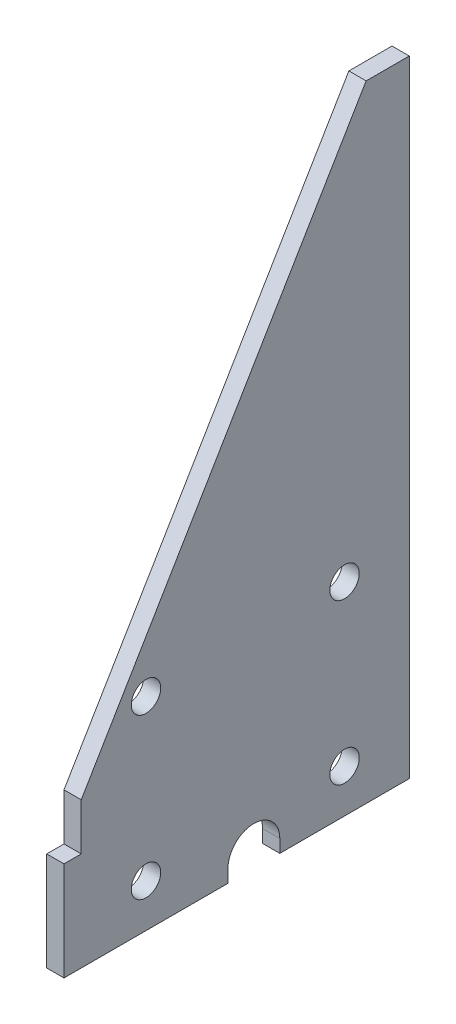
from build123d import *

# Parameters (mm, degrees)
BOSS_EXTRUDE1_DEPTH = 4
CUT_EXTRUDE1_REACH  = 99.14
SKETCH3_R           = 3.41
CUT_EXTRUDE2_REACH  = 99.14
SKETCH4_R           = 3.41
CUT_EXTRUDE4_REACH  = 99.14


with BuildPart() as part:
    # Sketch1 → Boss-Extrude1 (new body)
    with BuildSketch(Plane(origin=(0, 0, 0), x_dir=(0, 0, -1), z_dir=(1, 0, 0))):
        Polygon((-38, -57.5), (42, -57.5), (42, 87.5), (32, 87.5), (-34, -23.740343039), (-34, -34.602813771), (-38, -34.602813771), align=None)
    extrude(amount=BOSS_EXTRUDE1_DEPTH)

    # Sketch3 → Cut-Extrude1 (cut, up to next)
    with BuildSketch(Plane.ZY, mode=Mode.PRIVATE) as cut_extrude1_sk1:
        with Locations((-27, -10.5)):
            Circle(SKETCH3_R)
    cut_extrude1_tool1 = extrude(cut_extrude1_sk1.sketch, amount=-CUT_EXTRUDE1_REACH, mode=Mode.PRIVATE) & part.part
    # Sketch3 → Cut-Extrude1 (cut, up to next)
    with BuildSketch(Plane.ZY, mode=Mode.PRIVATE) as cut_extrude1_sk2:
        with Locations((19, -10.5)):
            Circle(SKETCH3_R)
    cut_extrude1_tool2 = extrude(cut_extrude1_sk2.sketch, amount=-CUT_EXTRUDE1_REACH, mode=Mode.PRIVATE) & part.part
    add(cut_extrude1_tool1.solids().sort_by_distance((0, -10.5, -27))[0], mode=Mode.SUBTRACT)
    add(cut_extrude1_tool2.solids().sort_by_distance((0, -10.5, 19))[0], mode=Mode.SUBTRACT)

    # Sketch4 → Cut-Extrude2 (cut, up to next)
    with BuildSketch(Plane.ZY, mode=Mode.PRIVATE) as cut_extrude2_sk1:
        with Locations((-27, -47.5)):
            Circle(SKETCH4_R)
    cut_extrude2_tool1 = extrude(cut_extrude2_sk1.sketch, amount=-CUT_EXTRUDE2_REACH, mode=Mode.PRIVATE) & part.part
    # Sketch4 → Cut-Extrude2 (cut, up to next)
    with BuildSketch(Plane.ZY, mode=Mode.PRIVATE) as cut_extrude2_sk2:
        with Locations((19, -47.5)):
            Circle(SKETCH4_R)
    cut_extrude2_tool2 = extrude(cut_extrude2_sk2.sketch, amount=-CUT_EXTRUDE2_REACH, mode=Mode.PRIVATE) & part.part
    add(cut_extrude2_tool1.solids().sort_by_distance((0, -47.5, -27))[0], mode=Mode.SUBTRACT)
    add(cut_extrude2_tool2.solids().sort_by_distance((0, -47.5, 19))[0], mode=Mode.SUBTRACT)

    # Sketch6 → Cut-Extrude4 (cut, up to next)
    with BuildSketch(Plane(origin=(4, 0, 0), x_dir=(0, 0, -1), z_dir=(1, 0, 0)), mode=Mode.PRIVATE) as cut_extrude4_sk1:
        with BuildLine():
            Line((0, -54.5), (0, -57.5))
            Line((0, -57.5), (12, -57.5))
            Line((12, -57.5), (12, -54.5))
            ThreePointArc((12, -54.5), (6, -48.5), (0, -54.5))
        make_face()
    cut_extrude4_tool1 = extrude(cut_extrude4_sk1.sketch, amount=-CUT_EXTRUDE4_REACH, mode=Mode.PRIVATE) & part.part
    add(cut_extrude4_tool1.solids().sort_by_distance((4, -53.527539, -6))[0], mode=Mode.SUBTRACT)


solid = part.part
